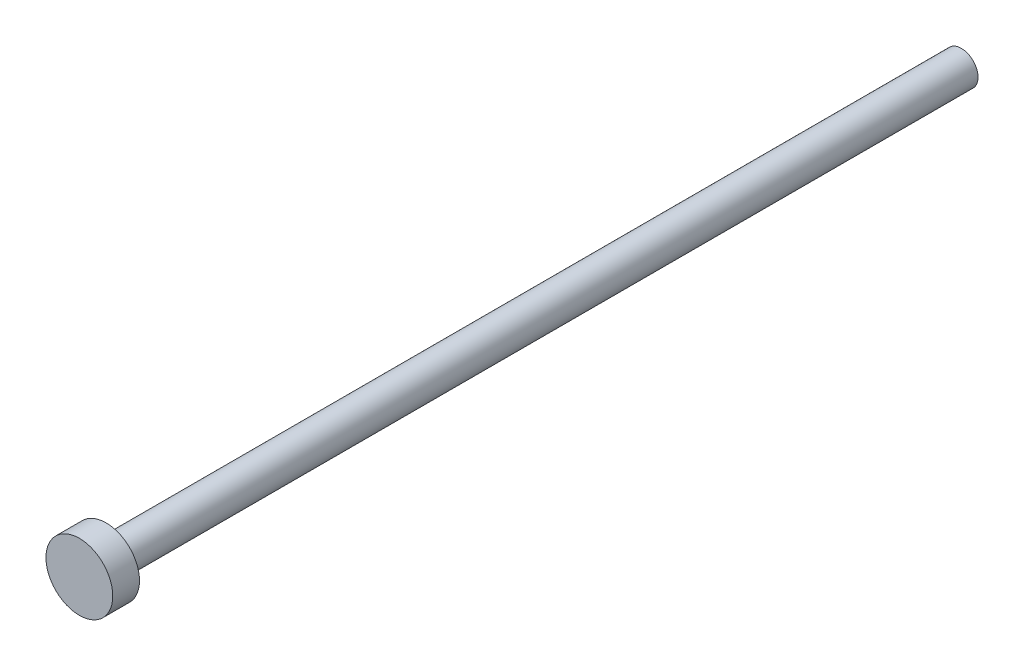
from build123d import *

# Parameters (mm, degrees)
SKETCH1_R           = 1.25
BOSS_EXTRUDE1_DEPTH = 1
SKETCH2_R           = 0.625
BOSS_EXTRUDE2_DEPTH = 32


with BuildPart() as part:
    # Sketch1 → Boss-Extrude1 (new body)
    with BuildSketch(Plane.XY):
        Circle(SKETCH1_R)
    extrude(amount=BOSS_EXTRUDE1_DEPTH)

    # Sketch2 → Boss-Extrude2 (add)
    with BuildSketch(Plane(origin=(0, 0, 0), x_dir=(-1, 0, 0), z_dir=(0, 0, -1))):
        Circle(SKETCH2_R)
    extrude(amount=BOSS_EXTRUDE2_DEPTH)


solid = part.part
